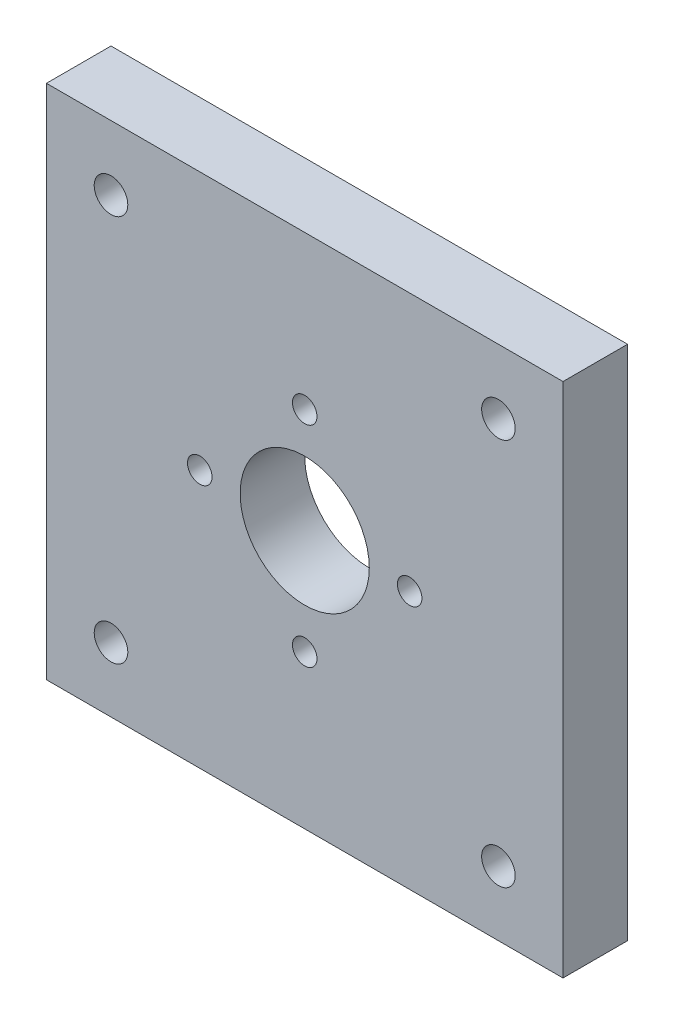
from build123d import *

# Parameters (mm, degrees)
SKETCH1_W           = 4
SKETCH1_H           = 4
SKETCH1_R           = 0.5
SKETCH1_R_2         = 0.095
SKETCH1_R_3         = 0.13
BOSS_EXTRUDE1_DEPTH = 0.5


with BuildPart() as part:
    # Sketch1 → Boss-Extrude1 (new body)
    with BuildSketch(Plane.XY):
        with Locations((2, 2)):
            Rectangle(SKETCH1_W, SKETCH1_H)
        with Locations((2, 2)):
            Circle(SKETCH1_R, mode=Mode.SUBTRACT)
        with Locations((2, 2.8125)):
            Circle(SKETCH1_R_2, mode=Mode.SUBTRACT)
        with Locations((0.5, 3.5)):
            Circle(SKETCH1_R_3, mode=Mode.SUBTRACT)
        with Locations((3.5, 3.5)):
            Circle(SKETCH1_R_3, mode=Mode.SUBTRACT)
        with Locations((2.8125, 2)):
            Circle(SKETCH1_R_2, mode=Mode.SUBTRACT)
        with Locations((2, 1.1875)):
            Circle(SKETCH1_R_2, mode=Mode.SUBTRACT)
        with Locations((1.1875, 2)):
            Circle(SKETCH1_R_2, mode=Mode.SUBTRACT)
        with Locations(Location((3.5, 0.5, 0), (0, 0, 180))):
            Circle(SKETCH1_R_3, mode=Mode.SUBTRACT)
        with Locations(Location((0.5, 0.5, 0), (0, 0, 180))):
            Circle(SKETCH1_R_3, mode=Mode.SUBTRACT)
    extrude(amount=BOSS_EXTRUDE1_DEPTH)


solid = part.part
